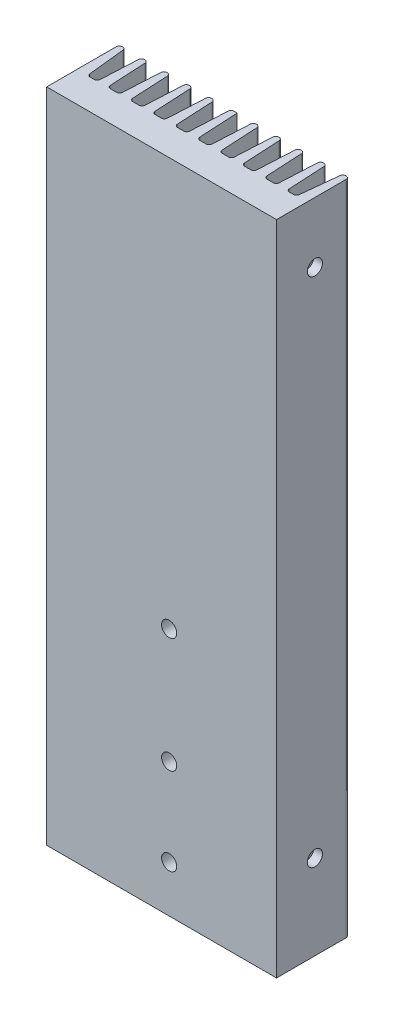
from build123d import *

# Parameters (mm, degrees)
EXTRUDE1_DEPTH            = 108.6
BOSS_EXTRUDE1_DEPTH       = 108.6
LPATTERN1_COUNT           = 9
LPATTERN1_PITCH           = 3.7
FILLET1_R                 = 0.5
FILLET2_R                 = 0.5
M3X0_5_TAPPED_HOLE1_D     = 2.5
M3X0_5_TAPPED_HOLE1_DEPTH = 6.5
M3X0_5_TAPPED_HOLE1_TIP   = 0.751075774
M3X0_5_TAPPED_HOLE2_D     = 2.5
M3X0_5_TAPPED_HOLE2_DEPTH = 5
M3X0_5_TAPPED_HOLE2_TIP   = 0.751075774


with BuildPart() as part:
    # Sketch1 → Extrude1 (new body)
    with BuildSketch(Plane(origin=(0, 0, 0), x_dir=(1, 0, 0), z_dir=(0, 1, 0))):
        Polygon((0, 12), (0, 0), (38, 0), (38, 12), (37, 12), (36.264270353, 5), (1.735729647, 5), (1, 12), align=None)
    extrude(amount=EXTRUDE1_DEPTH)

    # Sketch3 → Boss-Extrude1 (add)
    with BuildSketch(Plane(origin=(0, 108.6, 0), x_dir=(1, 0, 0), z_dir=(0, 1, 0))):
        Polygon((3.333145545, 5), (3.7, 12), (4.7, 12), (5.066854455, 5), align=None)
    boss_extrude1 = extrude(amount=-BOSS_EXTRUDE1_DEPTH)

    # LPattern1: Boss-Extrude1 ×9
    with Locations(*[(i * LPATTERN1_PITCH, 0, 0) for i in range(1, LPATTERN1_COUNT)]):
        add(boss_extrude1)

    # Fillet1
    fillet1_edges = [part.edges().sort_by_distance(p)[0] for p in [
        (34.666854455, 54.3, -5),
        (32.933145545, 54.3, -5),
        (1.735729647, 54.3, -5),
        (36.264270353, 54.3, -5),
        (5.066854455, 54.3, -5),
        (3.333145545, 54.3, -5),
        (8.766854455, 54.3, -5),
        (7.033145545, 54.3, -5),
        (12.466854455, 54.3, -5),
        (10.733145545, 54.3, -5),
        (16.166854455, 54.3, -5),
        (14.433145545, 54.3, -5),
        (19.866854455, 54.3, -5),
        (18.133145545, 54.3, -5),
        (23.566854455, 54.3, -5),
        (21.833145545, 54.3, -5),
        (27.266854455, 54.3, -5),
        (25.533145545, 54.3, -5),
        (30.966854455, 54.3, -5),
        (29.233145545, 54.3, -5),
    ]]
    fillet(fillet1_edges, radius=FILLET1_R)

    # Fillet2
    fillet2_edges = [part.edges().sort_by_distance(p)[0] for p in [
        (33.3, 54.3, -12),
        (34.3, 54.3, -12),
        (1, 54.3, -12),
        (37, 54.3, -12),
        (38, 54.3, -12),
        (0, 54.3, -12),
        (3.7, 54.3, -12),
        (4.7, 54.3, -12),
        (7.4, 54.3, -12),
        (8.4, 54.3, -12),
        (11.1, 54.3, -12),
        (12.1, 54.3, -12),
        (14.8, 54.3, -12),
        (15.8, 54.3, -12),
        (18.5, 54.3, -12),
        (22.2, 54.3, -12),
        (23.2, 54.3, -12),
        (25.9, 54.3, -12),
        (26.9, 54.3, -12),
        (29.6, 54.3, -12),
        (30.6, 54.3, -12),
    ]]
    fillet(fillet2_edges, radius=FILLET2_R)

    # M3x0.5 Tapped Hole1
    with Locations(Plane(origin=(38, 0, 0), x_dir=(0, 0, -1), z_dir=(1, 0, 0))):
        with Locations((6.35, 98.6), (6.35, 14)):
            Hole(M3X0_5_TAPPED_HOLE1_D / 2, depth=M3X0_5_TAPPED_HOLE1_DEPTH)
            with Locations((0, 0, -(M3X0_5_TAPPED_HOLE1_DEPTH + M3X0_5_TAPPED_HOLE1_TIP / 2))):  # 118° drill point
                Cone(0, M3X0_5_TAPPED_HOLE1_D / 2, M3X0_5_TAPPED_HOLE1_TIP, mode=Mode.SUBTRACT)

    # M3x0.5 Tapped Hole2
    with Locations(Plane.XY):
        with Locations((20.25, 41.11), (20.25, 22.11), (20.25, 7.71)):
            Hole(M3X0_5_TAPPED_HOLE2_D / 2, depth=M3X0_5_TAPPED_HOLE2_DEPTH)
            with Locations((0, 0, -(M3X0_5_TAPPED_HOLE2_DEPTH + M3X0_5_TAPPED_HOLE2_TIP / 2))):  # 118° drill point
                Cone(0, M3X0_5_TAPPED_HOLE2_D / 2, M3X0_5_TAPPED_HOLE2_TIP, mode=Mode.SUBTRACT)


solid = part.part
